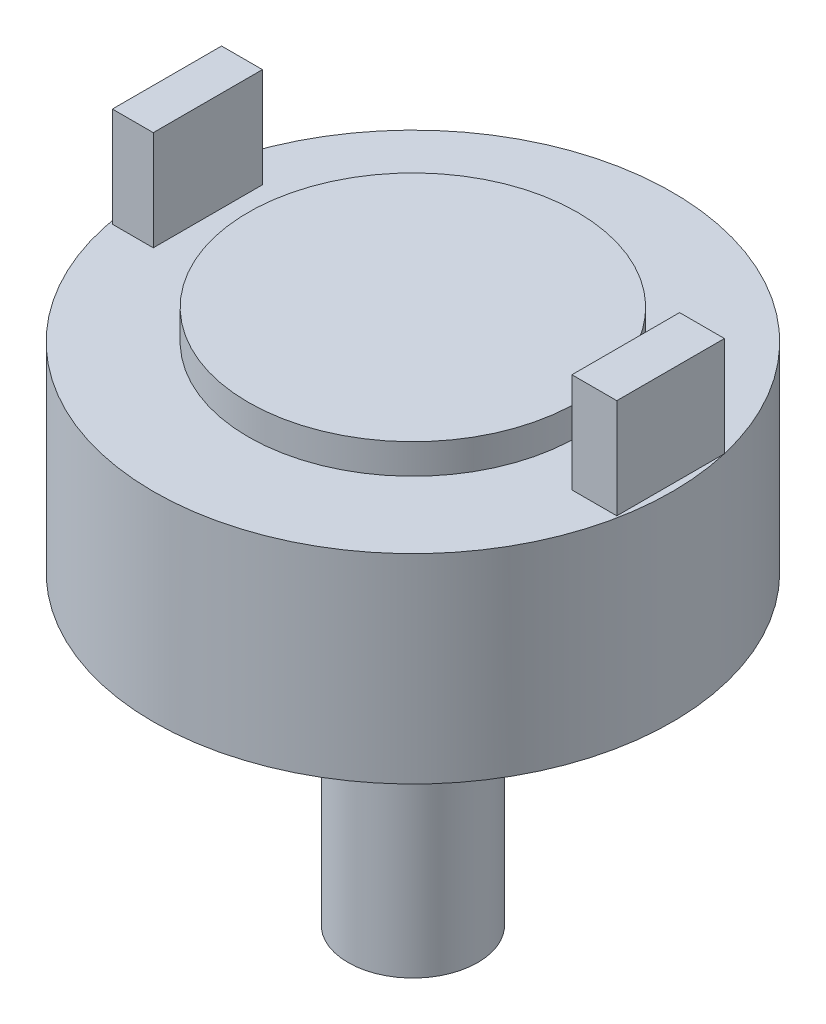
from build123d import *

# Parameters (mm, degrees)
SKETCH3_R                = 26
SKETCH3_R_2              = 16.5
BOSS_EXTRUDE1_DEPTH      = 20
BOSS_EXTRUDE2_DEPTH      = 3
BOSS_EXTRUDE2_DEPTH_BACK = 10.632617726
SKETCH4_R                = 16.5
SKETCH5_R                = 6.5
BOSS_EXTRUDE3_DEPTH      = 40
SKETCH6_W                = 4.097278351
SKETCH6_H                = 10.943831221
SKETCH6_W_2              = 4.498249096
SKETCH6_H_2              = 10.789499657
BOSS_EXTRUDE4_DEPTH      = 10


with BuildPart() as part:
    # Sketch3 → Boss-Extrude1 (new body)
    with BuildSketch(Plane(origin=(0, 0, 0), x_dir=(1, 0, 0), z_dir=(0, 1, 0))):
        with Locations(Location((0, 0, 0), (0, 0, 270))):
            Circle(SKETCH3_R)
        with Locations(Location((0, 0, 0), (0, 0, 270))):
            Circle(SKETCH3_R_2, mode=Mode.SUBTRACT)
    extrude(amount=BOSS_EXTRUDE1_DEPTH)



with BuildPart() as body_2:
    # Sketch4 → Boss-Extrude2 (new, two sides: drawn at the far end of the back side and taken through both)
    with BuildSketch(Plane(origin=(0, 20, 0), x_dir=(1, 0, 0), z_dir=(0, 1, 0)).offset(-BOSS_EXTRUDE2_DEPTH_BACK)):
        with Locations(Location((0, 0, 0), (0, 0, 270))):
            Circle(SKETCH4_R)
    extrude(amount=BOSS_EXTRUDE2_DEPTH + BOSS_EXTRUDE2_DEPTH_BACK)


with BuildPart() as part_1:
    add(part.part)

    add(body_2.part)  # Boss-Extrude3 merges body 2
    # Sketch5 → Boss-Extrude3 (add)
    with BuildSketch(Plane.XZ.offset(-9.367382274)):
        with Locations(Location((0, 0, 0), (0, 0, 90))):
            Circle(SKETCH5_R)
    extrude(amount=BOSS_EXTRUDE3_DEPTH)

    # Sketch6 → Boss-Extrude4 (add)
    with BuildSketch(Plane(origin=(0, 20, 0), x_dir=(1, 0, 0), z_dir=(0, 1, 0))):
        with Locations((-23.226769419, 0.623469561)):
            Rectangle(SKETCH6_W, SKETCH6_H)
        with Locations((23.070994305, 0.512159793)):
            Rectangle(SKETCH6_W_2, SKETCH6_H_2)
    extrude(amount=BOSS_EXTRUDE4_DEPTH)


solid = part_1.part
